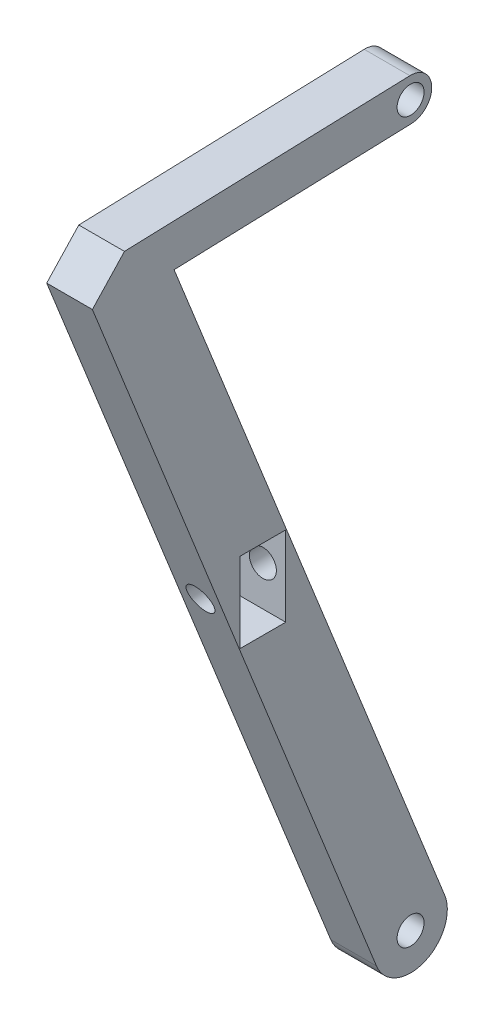
from build123d import *

# Parameters (mm, degrees)
BOSS_EXTRUDE1_DEPTH     = 2.54
SKETCH2_W               = 5.08
SKETCH2_H               = 8.89
CUT_EXTRUDE1_DEPTH      = 5.08
CUT_EXTRUDE2_DEPTH      = 86.150645665
CUT_EXTRUDE2_DEPTH_BACK = 86.150645665
SKETCH3_R               = 1.5


with BuildPart() as part:
    # Sketch1 → Boss-Extrude1 (new, symmetric)
    with BuildSketch(Plane(origin=(0, 0, 0), x_dir=(0, 0, -1), z_dir=(1, 0, 0))):
        with BuildLine():
            ThreePointArc((-3.792924612, -1.516297351), (1.516297351, -3.792924612), (3.792924612, 1.516297351))
            Line((3.792924612, 1.516297351), (0, 11.004065103))
            Line((0, 11.004065103), (-26.293066659, 76.774555024))
            Line((-26.293066659, 76.774555024), (0, 77.645444775))
            Line((0, 77.645444775), (0, 77.657240774))
            Line((0, 77.657240774), (0.077903078, 77.648025113))
            ThreePointArc((0.077903078, 77.648025113), (2.351974887, 80.077903078), (-0.077903078, 82.351974887))
            Line((-0.077903078, 82.351974887), (-31.810501027, 81.300914746))
            Line((-31.810501027, 81.300914746), (-35.377927791, 77.491646464))
            Line((-35.377927791, 77.491646464), (-3.792924612, -1.516297351))
        make_face()
        with BuildLine():
            ThreePointArc((1.5, 0), (-1.060660172, -1.060660172), (0, 1.5))
            ThreePointArc((0, 1.5), (1.060660172, 1.060660172), (1.5, 0))
        make_face(mode=Mode.SUBTRACT)
        with BuildLine():
            ThreePointArc((1.5, 80), (1.060660172, 78.939339828), (0, 78.5))
            ThreePointArc((0, 78.5), (-1.060660172, 81.060660172), (1.5, 80))
        make_face(mode=Mode.SUBTRACT)
    extrude(amount=BOSS_EXTRUDE1_DEPTH, both=True)

    # Sketch2 → Cut-Extrude1 (cut)
    with BuildSketch(Plane(origin=(2.54, 0, 0), x_dir=(0, 0, -1), z_dir=(1, 0, 0))):
        with Locations((-16.420936138, 41.075962298)):
            Rectangle(SKETCH2_W, SKETCH2_H)
    extrude(amount=-CUT_EXTRUDE1_DEPTH, mode=Mode.SUBTRACT)

    # Sketch3 → Cut-Extrude2 (cut, two sides: drawn at the far end of the back side and taken through both)
    with BuildSketch(Plane.XY.offset(13.880936138).offset(-CUT_EXTRUDE2_DEPTH_BACK)):
        with Locations(Location((0, 41.075962298, 0), (0, 0, 90))):
            Circle(SKETCH3_R)
    extrude(amount=CUT_EXTRUDE2_DEPTH + CUT_EXTRUDE2_DEPTH_BACK, mode=Mode.SUBTRACT)


solid = part.part
